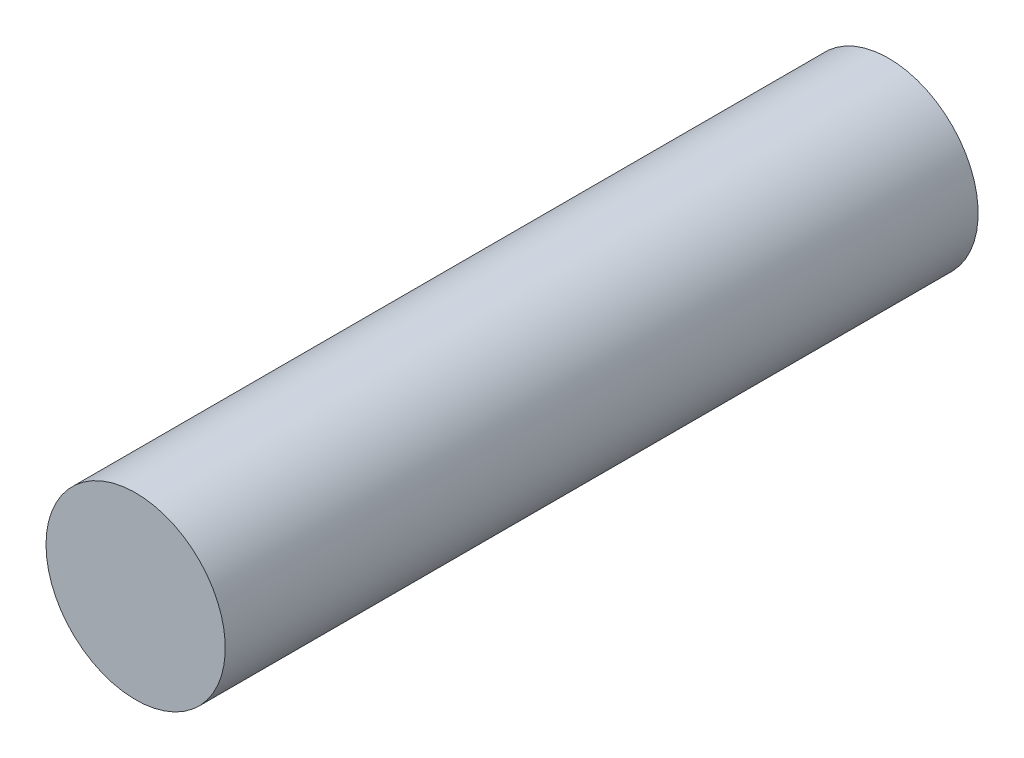
from build123d import *

# Parameters (mm, degrees)
SKETCH1_R           = 2.5
BOSS_EXTRUDE1_DEPTH = 21


with BuildPart() as part:
    # Sketch1 → Boss-Extrude1 (new body)
    with BuildSketch(Plane.XY):
        with Locations(Location((0, 0, 0), (0, 0, 180))):
            Circle(SKETCH1_R)
    extrude(amount=BOSS_EXTRUDE1_DEPTH)


solid = part.part
